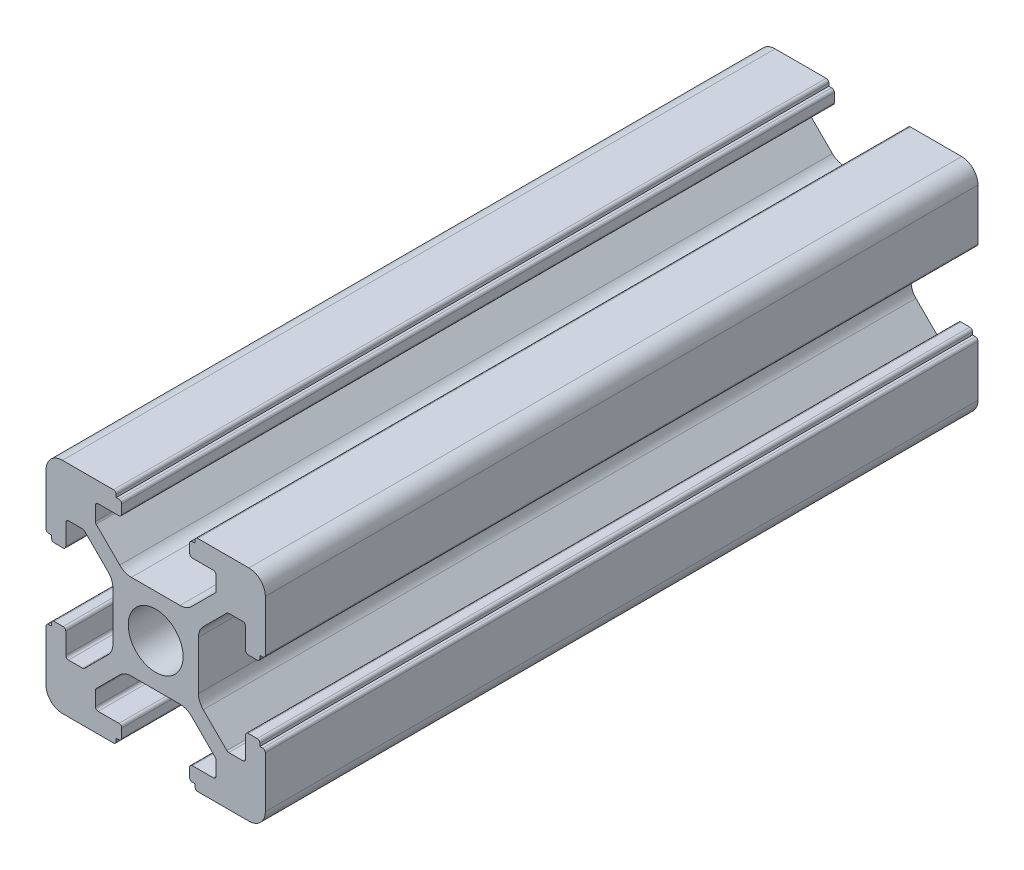
from build123d import *

# Parameters (mm, degrees)
SKETCH_1_R      = 2.5
EXTRUDE_1_DEPTH = 65


with BuildPart() as part:
    # 草图1 → 凸台-拉伸1 (new body)
    with BuildSketch(Plane.XY):
        with BuildLine():
            Line((-8.502261885, -10.002261885), (-3.85, -10.002261885))
            ThreePointArc((-3.85, -10.002261885), (-3.673223305, -9.929038581), (-3.6, -9.752261885))
            Line((-3.6, -9.752261885), (-3.6, -9.502261885))
            Line((-3.6, -9.502261885), (-3.35, -9.502261885))
            ThreePointArc((-3.35, -9.502261885), (-3.173223305, -9.429038581), (-3.1, -9.252261885))
            Line((-3.1, -9.252261885), (-3.1, -8.45))
            ThreePointArc((-3.1, -8.45), (-3.173223305, -8.273223305), (-3.35, -8.2))
            Line((-3.35, -8.2), (-5.25, -8.2))
            ThreePointArc((-5.25, -8.2), (-5.426776695, -8.126776695), (-5.5, -7.95))
            Line((-5.5, -7.95), (-5.5, -6.664213562))
            ThreePointArc((-5.5, -6.664213562), (-5.480969883, -6.568542704), (-5.426776695, -6.487436867))
            Line((-5.426776695, -6.487436867), (-3.278679656, -4.339339828))
            ThreePointArc((-3.278679656, -4.339339828), (-2.792044633, -4.014180701), (-2.218019485, -3.9))
            Line((-2.218019485, -3.9), (2.218019485, -3.9))
            ThreePointArc((2.218019485, -3.9), (2.792044633, -4.014180701), (3.278679656, -4.339339828))
            Line((3.278679656, -4.339339828), (5.426776695, -6.487436867))
            ThreePointArc((5.426776695, -6.487436867), (5.480969883, -6.568542704), (5.5, -6.664213562))
            Line((5.5, -6.664213562), (5.5, -7.95))
            ThreePointArc((5.5, -7.95), (5.426776695, -8.126776695), (5.25, -8.2))
            Line((5.25, -8.2), (3.35, -8.2))
            ThreePointArc((3.35, -8.2), (3.173223305, -8.273223305), (3.1, -8.45))
            Line((3.1, -8.45), (3.1, -9.252261885))
            ThreePointArc((3.1, -9.252261885), (3.173223305, -9.429038581), (3.35, -9.502261885))
            Line((3.35, -9.502261885), (3.6, -9.502261885))
            Line((3.6, -9.502261885), (3.6, -9.752261885))
            ThreePointArc((3.6, -9.752261885), (3.673223305, -9.929038581), (3.85, -10.002261885))
            Line((3.85, -10.002261885), (8.502261885, -10.002261885))
            ThreePointArc((8.502261885, -10.002261885), (9.562922057, -9.562922057), (10.002261885, -8.502261885))
            Line((10.002261885, -8.502261885), (10.002261885, -3.85))
            ThreePointArc((10.002261885, -3.85), (9.929038581, -3.673223305), (9.752261885, -3.6))
            Line((9.752261885, -3.6), (9.502261885, -3.6))
            Line((9.502261885, -3.6), (9.502261885, -3.35))
            ThreePointArc((9.502261885, -3.35), (9.429038581, -3.173223305), (9.252261885, -3.1))
            Line((9.252261885, -3.1), (8.45, -3.1))
            ThreePointArc((8.45, -3.1), (8.273223305, -3.173223305), (8.2, -3.35))
            Line((8.2, -3.35), (8.2, -5.25))
            ThreePointArc((8.2, -5.25), (8.126776695, -5.426776695), (7.95, -5.5))
            Line((7.95, -5.5), (6.664213562, -5.5))
            ThreePointArc((6.664213562, -5.5), (6.568542704, -5.480969883), (6.487436867, -5.426776695))
            Line((6.487436867, -5.426776695), (4.339339828, -3.278679656))
            ThreePointArc((4.339339828, -3.278679656), (4.014180701, -2.792044633), (3.9, -2.218019485))
            Line((3.9, -2.218019485), (3.9, 2.218019485))
            ThreePointArc((3.9, 2.218019485), (4.014180701, 2.792044633), (4.339339828, 3.278679656))
            Line((4.339339828, 3.278679656), (6.487436867, 5.426776695))
            ThreePointArc((6.487436867, 5.426776695), (6.568542704, 5.480969883), (6.664213562, 5.5))
            Line((6.664213562, 5.5), (7.95, 5.5))
            ThreePointArc((7.95, 5.5), (8.126776695, 5.426776695), (8.2, 5.25))
            Line((8.2, 5.25), (8.2, 3.35))
            ThreePointArc((8.2, 3.35), (8.273223305, 3.173223305), (8.45, 3.1))
            Line((8.45, 3.1), (9.252261885, 3.1))
            ThreePointArc((9.252261885, 3.1), (9.429038581, 3.173223305), (9.502261885, 3.35))
            Line((9.502261885, 3.35), (9.502261885, 3.6))
            Line((9.502261885, 3.6), (9.752261885, 3.6))
            ThreePointArc((9.752261885, 3.6), (9.929038581, 3.673223305), (10.002261885, 3.85))
            Line((10.002261885, 3.85), (10.002261885, 8.502261885))
            ThreePointArc((10.002261885, 8.502261885), (9.562922057, 9.562922057), (8.502261885, 10.002261885))
            Line((8.502261885, 10.002261885), (3.85, 10.002261885))
            ThreePointArc((3.85, 10.002261885), (3.673223305, 9.929038581), (3.6, 9.752261885))
            Line((3.6, 9.752261885), (3.6, 9.502261885))
            Line((3.6, 9.502261885), (3.35, 9.502261885))
            ThreePointArc((3.35, 9.502261885), (3.173223305, 9.429038581), (3.1, 9.252261885))
            Line((3.1, 9.252261885), (3.1, 8.45))
            ThreePointArc((3.1, 8.45), (3.173223305, 8.273223305), (3.35, 8.2))
            Line((3.35, 8.2), (5.25, 8.2))
            ThreePointArc((5.25, 8.2), (5.426776695, 8.126776695), (5.5, 7.95))
            Line((5.5, 7.95), (5.5, 6.664213562))
            ThreePointArc((5.5, 6.664213562), (5.480969883, 6.568542704), (5.426776695, 6.487436867))
            Line((5.426776695, 6.487436867), (3.278679656, 4.339339828))
            ThreePointArc((3.278679656, 4.339339828), (2.792044633, 4.014180701), (2.218019485, 3.9))
            Line((2.218019485, 3.9), (-2.218019485, 3.9))
            ThreePointArc((-2.218019485, 3.9), (-2.792044633, 4.014180701), (-3.278679656, 4.339339828))
            Line((-3.278679656, 4.339339828), (-5.426776695, 6.487436867))
            ThreePointArc((-5.426776695, 6.487436867), (-5.480969883, 6.568542704), (-5.5, 6.664213562))
            Line((-5.5, 6.664213562), (-5.5, 7.95))
            ThreePointArc((-5.5, 7.95), (-5.426776695, 8.126776695), (-5.25, 8.2))
            Line((-5.25, 8.2), (-3.35, 8.2))
            ThreePointArc((-3.35, 8.2), (-3.173223305, 8.273223305), (-3.1, 8.45))
            Line((-3.1, 8.45), (-3.1, 9.252261885))
            ThreePointArc((-3.1, 9.252261885), (-3.173223305, 9.429038581), (-3.35, 9.502261885))
            Line((-3.35, 9.502261885), (-3.6, 9.502261885))
            Line((-3.6, 9.502261885), (-3.6, 9.752261885))
            ThreePointArc((-3.6, 9.752261885), (-3.673223305, 9.929038581), (-3.85, 10.002261885))
            Line((-3.85, 10.002261885), (-8.502261885, 10.002261885))
            ThreePointArc((-8.502261885, 10.002261885), (-9.562922057, 9.562922057), (-10.002261885, 8.502261885))
            Line((-10.002261885, 8.502261885), (-10.002261885, 3.85))
            ThreePointArc((-10.002261885, 3.85), (-9.929038581, 3.673223305), (-9.752261885, 3.6))
            Line((-9.752261885, 3.6), (-9.502261885, 3.6))
            Line((-9.502261885, 3.6), (-9.502261885, 3.35))
            ThreePointArc((-9.502261885, 3.35), (-9.429038581, 3.173223305), (-9.252261885, 3.1))
            Line((-9.252261885, 3.1), (-8.45, 3.1))
            ThreePointArc((-8.45, 3.1), (-8.273223305, 3.173223305), (-8.2, 3.35))
            Line((-8.2, 3.35), (-8.2, 5.25))
            ThreePointArc((-8.2, 5.25), (-8.126776695, 5.426776695), (-7.95, 5.5))
            Line((-7.95, 5.5), (-6.664213562, 5.5))
            ThreePointArc((-6.664213562, 5.5), (-6.568542704, 5.480969883), (-6.487436867, 5.426776695))
            Line((-6.487436867, 5.426776695), (-4.339339828, 3.278679656))
            ThreePointArc((-4.339339828, 3.278679656), (-4.014180701, 2.792044633), (-3.9, 2.218019485))
            Line((-3.9, 2.218019485), (-3.9, -2.218019485))
            ThreePointArc((-3.9, -2.218019485), (-4.014180701, -2.792044633), (-4.339339828, -3.278679656))
            Line((-4.339339828, -3.278679656), (-6.487436867, -5.426776695))
            ThreePointArc((-6.487436867, -5.426776695), (-6.568542704, -5.480969883), (-6.664213562, -5.5))
            Line((-6.664213562, -5.5), (-7.95, -5.5))
            ThreePointArc((-7.95, -5.5), (-8.126776695, -5.426776695), (-8.2, -5.25))
            Line((-8.2, -5.25), (-8.2, -3.35))
            ThreePointArc((-8.2, -3.35), (-8.273223305, -3.173223305), (-8.45, -3.1))
            Line((-8.45, -3.1), (-9.252261885, -3.1))
            ThreePointArc((-9.252261885, -3.1), (-9.429038581, -3.173223305), (-9.502261885, -3.35))
            Line((-9.502261885, -3.35), (-9.502261885, -3.6))
            Line((-9.502261885, -3.6), (-9.752261885, -3.6))
            ThreePointArc((-9.752261885, -3.6), (-9.929038581, -3.673223305), (-10.002261885, -3.85))
            Line((-10.002261885, -3.85), (-10.002261885, -8.502261885))
            ThreePointArc((-10.002261885, -8.502261885), (-9.562922057, -9.562922057), (-8.502261885, -10.002261885))
        make_face()
        Circle(SKETCH_1_R, mode=Mode.SUBTRACT)
    extrude(amount=EXTRUDE_1_DEPTH)


solid = part.part
